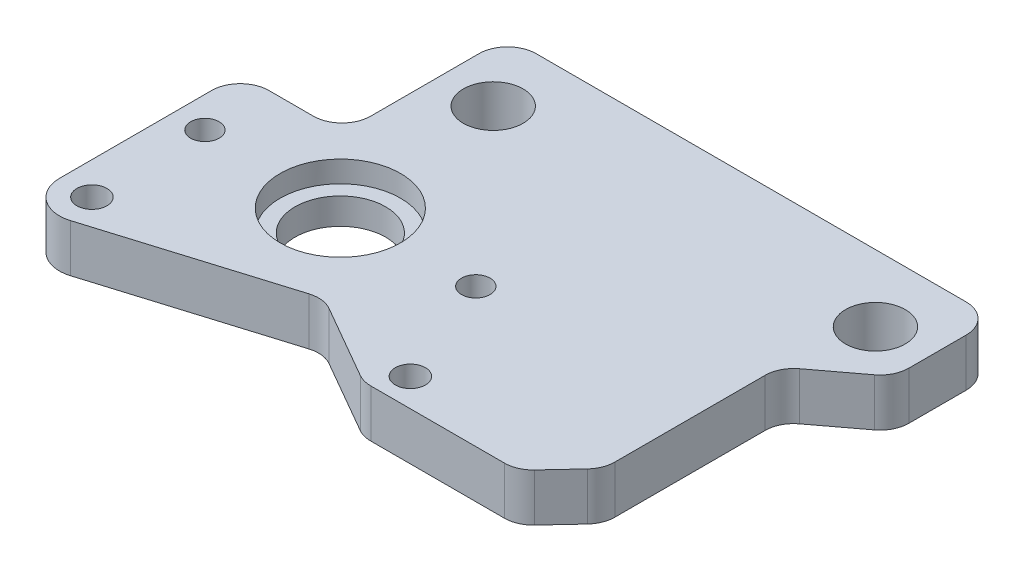
from build123d import *

# Parameters (mm, degrees)
SKETCH4_R           = 8
SKETCH4_R_2         = 3.96875
SKETCH4_R_3         = 2
SKETCH4_R_4         = 1.89865
BOSS_EXTRUDE2_DEPTH = 6.35
BOSS_EXTRUDE5_START = -3.5
SKETCH31_R          = 8
SKETCH31_R_2        = 6.025
BOSS_EXTRUDE5_DEPTH = 3.5


with BuildPart() as part:
    # Sketch4 → Boss-Extrude2 (new body)
    with BuildSketch(Plane(origin=(0, 0, 0), x_dir=(1, 0, 0), z_dir=(0, 1, 0))):
        with BuildLine():
            Line((40.257702493, -18.4375), (22.483900583, -18.4375))
            ThreePointArc((22.483900583, -18.4375), (21.500464498, -18.308390309), (20.583679925, -17.929811531))
            Line((20.583679925, -17.929811531), (10.779476649, -12.288263354))
            ThreePointArc((10.779476649, -12.288263354), (9.307944036, -11.804768953), (7.765559219, -11.946980575))
            Line((7.765559219, -11.946980575), (-16.517810325, -19.369406885))
            ThreePointArc((-16.517810325, -19.369406885), (-20.348558836, -18.710969534), (-22.098, -15.24))
            Line((-22.098, -15.24), (-22.098, 4.987500122))
            ThreePointArc((-22.098, 4.987500122), (-20.982076836, 7.681576958), (-18.288, 8.797500122))
            Line((-18.288, 8.797500122), (-12.3825, 8.797500122))
            ThreePointArc((-12.3825, 8.797500122), (-9.688423164, 9.913423286), (-8.5725, 12.607500122))
            Line((-8.5725, 12.607500122), (-8.5725, 26.9875))
            ThreePointArc((-8.5725, 26.9875), (-7.456576836, 29.681576836), (-4.7625, 30.7975))
            Line((-4.7625, 30.7975), (52.3875, 30.7975))
            ThreePointArc((52.3875, 30.7975), (55.081576836, 29.681576836), (56.1975, 26.9875))
            Line((56.1975, 26.9875), (56.1975, 19.362095927))
            ThreePointArc((56.1975, 19.362095927), (55.797199918, 17.662082259), (54.680415238, 16.319294633))
            Line((54.680415238, 16.319294633), (48.985566477, 12.027918285))
            ThreePointArc((48.985566477, 12.027918285), (47.868781798, 10.685130659), (47.468481715, 8.985116992))
            Line((47.468481715, 8.985116992), (47.468481715, -10.980610773))
            ThreePointArc((47.468481715, -10.980610773), (47.203372649, -12.376980446), (46.444939319, -13.579024524))
            Line((46.444939319, -13.579024524), (43.044160097, -17.225913752))
            ThreePointArc((43.044160097, -17.225913752), (41.776936446, -18.121498883), (40.257702493, -18.4375))
        make_face()
        with Locations(Location((0, 0, 0), (0, 0, 270))):
            Circle(SKETCH4_R, mode=Mode.SUBTRACT)
        with Locations(Location((-1.5875, 21.9075, 0), (0, 0, 270))):
            Circle(SKETCH4_R_2, mode=Mode.SUBTRACT)
        with Locations(Location((49.2125, 21.9075, 0), (0, 0, 270))):
            Circle(SKETCH4_R_2, mode=Mode.SUBTRACT)
        with Locations(Location((24.012521227, -14.703599027, 0), (0, 0, 270))):
            Circle(SKETCH4_R_3, mode=Mode.SUBTRACT)
        with Locations(Location((-17.78, -15.24, 0), (0, 0, 270))):
            Circle(SKETCH4_R_3, mode=Mode.SUBTRACT)
        with Locations(Location((18.000000004, 0, 0), (0, 0, 270))):
            Circle(SKETCH4_R_4, mode=Mode.SUBTRACT)
        with Locations(Location((-18.000000004, 0, 0), (0, 0, 270))):
            Circle(SKETCH4_R_4, mode=Mode.SUBTRACT)
    extrude(amount=-BOSS_EXTRUDE2_DEPTH)

    # Sketch31 → Boss-Extrude5 (add)
    with BuildSketch(Plane.XZ.offset(6.35).offset(BOSS_EXTRUDE5_START)):
        with Locations(Location((0, 0, 0), (0, 0, 90))):
            Circle(SKETCH31_R)
        with Locations(Location((0, 0, 0), (0, 0, 270))):
            Circle(SKETCH31_R_2, mode=Mode.SUBTRACT)
    extrude(amount=BOSS_EXTRUDE5_DEPTH)


solid = part.part
